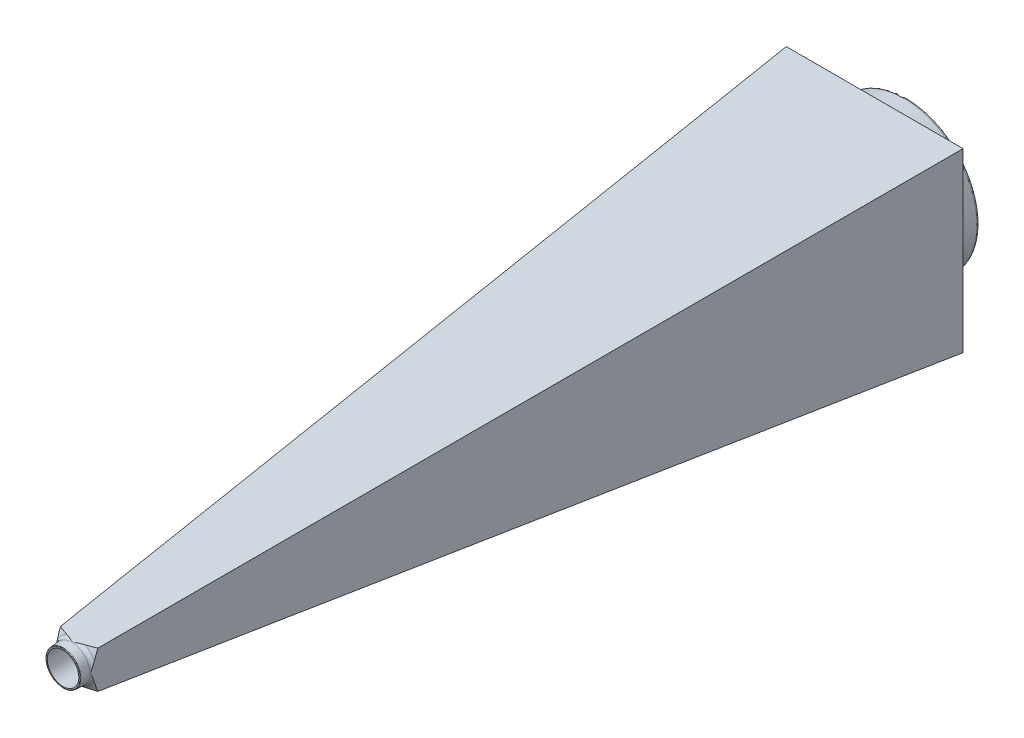
from build123d import *

# Parameters (mm, degrees)
SKETCH11_W                     = 36.563301826
SKETCH11_H                     = 1.5875
FILLET1_R                      = 0.254
CE_00_MILL_ONE_SIDE_FLAT_DEPTH = 12.7
CP_00_MILL_PATTERN_COUNT       = 4
FILLET2_R                      = 0.0508


with BuildPart() as part:
    # Sketch17 → BR-00 Lathe Initial (revolve)
    with BuildSketch(Plane(origin=(0, 0, 0), x_dir=(0, 0, -1), z_dir=(1, 0, 0)), mode=Mode.PRIVATE) as br_00_lathe_initial_sk:
        Polygon((105.41, 15.875), (105.41, 0), (17.129076381, 0), (17.129076381, 2.163905573), (40.590225916, 5.127738011), (40.590225916, 8.7376), (69.165225916, 8.7376), (69.165225916, 15.875), align=None)
    revolve(br_00_lathe_initial_sk.sketch.rotate(Axis((0, 0, -105.41), (0, 0, -1)), 180), axis=Axis((0, 0, -105.41), (0, 0, -1)))

    # Sketch11 → CR-00 Bore at tip (revolve, cut)
    with BuildSketch(Plane(origin=(0, 0, 0), x_dir=(0, 0, -1), z_dir=(1, 0, 0)), mode=Mode.PRIVATE) as cr_00_bore_at_tip_sk:
        with Locations((34.401809356, 0.79375)):
            Rectangle(SKETCH11_W, SKETCH11_H)
    revolve(cr_00_bore_at_tip_sk.sketch.rotate(Axis((0, 0, 50), (0, 0, -1)), 90), axis=Axis((0, 0, 50), (0, 0, -1)), mode=Mode.SUBTRACT)

    # Sketch16 → CR-00 Lathe at tip (revolve, cut)
    with BuildSketch(Plane(origin=(0, 0, 0), x_dir=(0, 0, -1), z_dir=(1, 0, 0)), mode=Mode.PRIVATE) as cr_00_lathe_at_tip_sk:
        with BuildLine():
            Line((15.596764062, 0.762), (17.637076381, 0.762))
            Line((17.637076381, 0.762), (20.471990781, 0.762))
            Line((20.471990781, 0.762), (20.471990781, 1.5875))
            Line((20.471990781, 1.5875), (19.959663009, 1.5875))
            Line((19.959663009, 1.5875), (19.959663009, 1.7399))
            Line((19.959663009, 1.7399), (20.848663009, 1.817677422))
            ThreePointArc((20.848663009, 1.817677422), (21.077336093, 1.895301474), (21.244328797, 2.069744329))
            Line((21.244328797, 2.069744329), (26.498763841, 11.17069279))
            Line((26.498763841, 11.17069279), (15.596764062, 11.17069279))
            Line((15.596764062, 11.17069279), (15.596764062, 0.762))
        make_face()
    revolve(cr_00_lathe_at_tip_sk.sketch.rotate(Axis((0, 0, -16.467430566), (0, 0, 1)), 90), axis=Axis((0, 0, -16.467430566), (0, 0, 1)), mode=Mode.SUBTRACT)

    # Sketch7 → CR-00 Bore form base ( flip around ) (revolve, cut)
    with BuildSketch(Plane(origin=(0, 0, 0), x_dir=(0, 0, -1), z_dir=(1, 0, 0)), mode=Mode.PRIVATE) as cr_00_bore_form_base_flip_around_sk:
        Polygon((42.949724835, 0), (137.038186875, 0), (137.038186875, 20.32), (101.6, 20.32), (101.6, 7.366), (104.775, 7.366), (104.775, 6.35), (92.075, 6.35), (60.96, 3.9751), (57.785, 3.9751), align=None)
    revolve(cr_00_bore_form_base_flip_around_sk.sketch.rotate(Axis((0, 0, -137.038186875), (0, 0, -1)), 90), axis=Axis((0, 0, -137.038186875), (0, 0, -1)), mode=Mode.SUBTRACT)

    # Sketch20 → CR-00 Lathe Next (revolve, cut)
    with BuildSketch(Plane(origin=(0, 0, 0), x_dir=(0, 0, -1), z_dir=(1, 0, 0)), mode=Mode.PRIVATE) as cr_00_lathe_next_sk:
        with BuildLine():
            Line((105.41, 13.316379782), (69.165225916, 8.7376))
            ThreePointArc((69.165225916, 8.7376), (68.56580235, 8.922006767), (68.307721992, 9.493591402))
            Line((68.307721992, 9.493591402), (68.307721992, 30.289247764))
            Line((68.307721992, 30.289247764), (105.41, 30.289247764))
            Line((105.41, 30.289247764), (105.41, 13.316379782))
        make_face()
    revolve(cr_00_lathe_next_sk.sketch.rotate(Axis((0, 0, -113.533763994), (0, 0, -1)), 270), axis=Axis((0, 0, -113.533763994), (0, 0, -1)), mode=Mode.SUBTRACT)

    # Fillet1
    fillet1_edges = [part.edges().sort_by_distance(p)[0] for p in [
        (-7.366, 0, -104.775),
    ]]
    fillet(fillet1_edges, radius=FILLET1_R)

    # Sketch18 → CE-00 Mill one side flat (cut, symmetric)
    with BuildSketch(Plane(origin=(0, 0, 0), x_dir=(0, 0, -1), z_dir=(1, 0, 0))):
        Polygon((125.778198054, 11.004166448), (12.733631993, 1.114048445), (12.733631993, 41.952542689), (125.778198054, 41.952542689), align=None)
    ce_00_mill_one_side_flat = extrude(amount=CE_00_MILL_ONE_SIDE_FLAT_DEPTH, both=True, mode=Mode.SUBTRACT)

    # CP-00 Mill pattern: CE-00 Mill one side flat ×4 about axis
    cp_00_mill_pattern_axis = Axis((0, 0, 0), (0, 0, 1))
    for i in range(1, CP_00_MILL_PATTERN_COUNT):
        add(ce_00_mill_one_side_flat.rotate(cp_00_mill_pattern_axis, i * 360 / CP_00_MILL_PATTERN_COUNT), mode=Mode.SUBTRACT)

    # Fillet2
    fillet2_edges = [part.edges().sort_by_distance(p)[0] for p in [
        (1.7399, 0, -19.959663009),
    ]]
    fillet(fillet2_edges, radius=FILLET2_R)


solid = part.part
